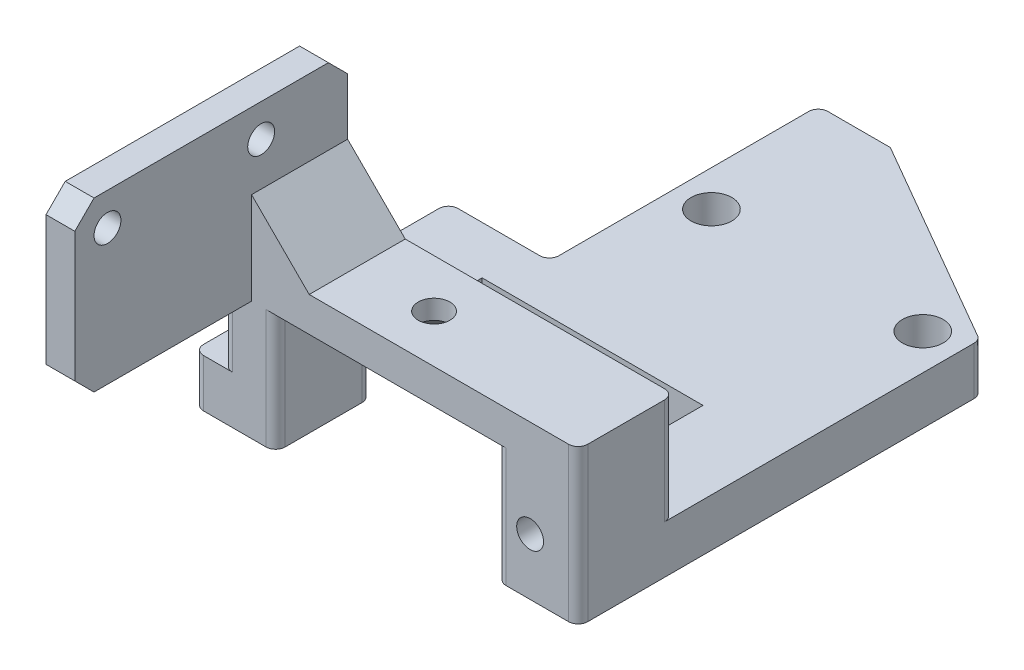
from build123d import *

# Parameters (mm, degrees)
BOSS_EXTRUDE1_DEPTH = 10
SKETCH5_R           = 1.4
CUT_EXTRUDE2_DEPTH  = 6
SKETCH4_R           = 1.75
CUT_EXTRUDE1_DEPTH  = 4.5
SKETCH6_R           = 1.75
SKETCH6_R_2         = 2.125
BOSS_EXTRUDE3_DEPTH = 5
BOSS_EXTRUDE4_START = -4
SKETCH6_3_R         = 1.75
BOSS_EXTRUDE4_DEPTH = 1
CUT_EXTRUDE3_DEPTH  = 5
SKETCH8_W           = 10
SKETCH8_H           = 11
CUT_EXTRUDE4_DEPTH  = 3
SKETCH10_R          = 1.4
BOSS_EXTRUDE5_DEPTH = 3
CHAMFER1_SIZE       = 2
FILLET1_R           = 1
CHAMFER2_SIZE       = 1.35
CHAMFER3_SIZE       = 6
SKETCH12_R          = 1.65
CUT_EXTRUDE6_DEPTH  = 61.634148794
CHAMFER4_SIZE       = 1.6


with BuildPart() as part:
    # Sketch2 → Boss-Extrude1 (new body)
    with BuildSketch(Plane.XY):
        Polygon((11.5, -6.2), (20, -6.2), (20, 9.8), (-20, 9.8), (-20, -6.2), (-11.5, -6.2), (-11.5, 6.2), (11.5, 6.2), align=None)
    extrude(amount=-BOSS_EXTRUDE1_DEPTH)

    # Sketch5 → Cut-Extrude2 (cut)
    with BuildSketch(Plane.XY):
        with Locations((15, -0.3)):
            Circle(SKETCH5_R)
    extrude(amount=-CUT_EXTRUDE2_DEPTH, mode=Mode.SUBTRACT)

    # Sketch4 → Cut-Extrude1 (cut)
    with BuildSketch(Plane.XZ.offset(6.2)):
        with Locations(Location((-17.25, -5, 0), (0, 0, 270))):
            Circle(SKETCH4_R)
        with Locations(Location((17.25, -5, 0), (0, 0, 270))):
            Circle(SKETCH4_R)
    extrude(amount=-CUT_EXTRUDE1_DEPTH, mode=Mode.SUBTRACT)

    # Sketch6 → Boss-Extrude3 (add)
    with BuildSketch(Plane.XZ.offset(6.2)):
        Polygon((-11.5, -10), (-20, -10), (-20, -26.5), (-9.5, -26.5), (-9.5, -54.5), (-2, -54.5), (20, -41.789296909), (20, -10), (11.5, -10), (11.5, -21.5), (-11.5, -21.5), align=None)
        with Locations(Location((-5.75, -28.5, 0), (0, 0, 270))):
            Circle(SKETCH6_R, mode=Mode.SUBTRACT)
        with Locations(Location((-5.75, -39.625, 0), (0, 0, 270))):
            Circle(SKETCH6_R_2, mode=Mode.SUBTRACT)
        with Locations(Location((-5.75, -50.75, 0), (0, 0, 270))):
            Circle(SKETCH6_R, mode=Mode.SUBTRACT)
        with Locations(Location((16.25, -39.625, 0), (0, 0, 270))):
            Circle(SKETCH6_R_2, mode=Mode.SUBTRACT)
    extrude(amount=-BOSS_EXTRUDE3_DEPTH)

    # Sketch6<3> → Boss-Extrude4 (add)
    with BuildSketch(Plane.XZ.offset(6.2).offset(BOSS_EXTRUDE4_START)):
        with Locations(Location((-5.75, -50.75, 0), (0, 0, 270))):
            Circle(SKETCH6_3_R)
        with Locations(Location((-5.75, -28.5, 0), (0, 0, 270))):
            Circle(SKETCH6_3_R)
    extrude(amount=-BOSS_EXTRUDE4_DEPTH)

    # Sketch7 → Cut-Extrude3 (cut)
    with BuildSketch(Plane(origin=(0, 0, -10), x_dir=(-1, 0, 0), z_dir=(0, 0, -1))):
        Polygon((11.5, -1.2), (11.5, -6.2), (15.5, -6.2), (20, -1.2), align=None)
    extrude(amount=CUT_EXTRUDE3_DEPTH, mode=Mode.SUBTRACT)

    # Sketch8 → Cut-Extrude4 (cut)
    with BuildSketch(Plane.ZY.offset(20)):
        with Locations((-5, 4.3)):
            Rectangle(SKETCH8_W, SKETCH8_H)
    extrude(amount=-CUT_EXTRUDE4_DEPTH, mode=Mode.SUBTRACT)

    # Sketch10 → Boss-Extrude5 (add)
    with BuildSketch(Plane.ZY.offset(17)):
        with BuildLine():
            Line((0, 6.2), (18.4, 6.2))
            Line((18.4, 6.2), (18.4, 23.7))
            Line((18.4, 23.7), (-10, 23.7))
            Line((-10, 23.7), (-10, -1.2))
            Line((-10, -1.2), (0, -1.2))
            Line((0, -1.2), (0, 3.320204103))
            ThreePointArc((0, 3.320204103), (-2.4, 4.3), (0, 5.279795897))
            Line((0, 5.279795897), (0, 6.2))
        make_face()
        with Locations(Location((-1, 20.3, 0), (0, 0, 270))):
            Circle(SKETCH10_R, mode=Mode.SUBTRACT)
        with Locations(Location((15, 20.3, 0), (0, 0, 270))):
            Circle(SKETCH10_R, mode=Mode.SUBTRACT)
    extrude(amount=-BOSS_EXTRUDE5_DEPTH)

    # Chamfer1
    chamfer1_edges = [part.edges().sort_by_distance(p)[0] for p in [
        (-15.5, 6.2, 18.4),
        (-15.5, 23.7, -10),
        (-15.5, 23.7, 18.4),
    ]]
    chamfer(chamfer1_edges, length=CHAMFER1_SIZE)

    # Fillet1
    fillet1_edges = [part.edges().sort_by_distance(p)[0] for p in [
        (-11.5, -3.7, -15),
        (20, 1.8, 0),
        (-20, -3.7, 0),
        (11.5, 0, 0),
        (-17, 2.5, 0),
        (-11.5, 0, -10),
        (20, 4.3, -10),
        (-9.5, -3.7, -54.5),
        (-9.5, -3.7, -26.5),
        (-20, -3.7, -26.5),
        (20, -3.7, -41.789296909),
        (11.5, 2.5, -10),
        (-11.5, 0, 0),
    ]]
    fillet(fillet1_edges, radius=FILLET1_R)

    # Chamfer2
    chamfer2_edges = [part.edges().sort_by_distance(p)[0] for p in [
        (-5.75, -6.2, -37.5),
        (16.25, -6.2, -37.5),
    ]]
    chamfer(chamfer2_edges, length=CHAMFER2_SIZE)

    # Chamfer3
    chamfer3_edges = [part.edges().sort_by_distance(p)[0] for p in [
        (-14, 9.8, -5),
    ]]
    chamfer(chamfer3_edges, length=CHAMFER3_SIZE)

    # Sketch12 → Cut-Extrude6 (cut, through all)
    with BuildSketch(Plane.XZ.offset(-6.2)):
        with Locations(Location((0, -5, 0), (0, 0, 270))):
            Circle(SKETCH12_R)
    extrude(amount=-CUT_EXTRUDE6_DEPTH, mode=Mode.SUBTRACT)

    # Chamfer4
    chamfer4_edges = [part.edges().sort_by_distance(p)[0] for p in [
        (0, 6.2, -3.35),
    ]]
    chamfer(chamfer4_edges, length=CHAMFER4_SIZE)


solid = part.part
